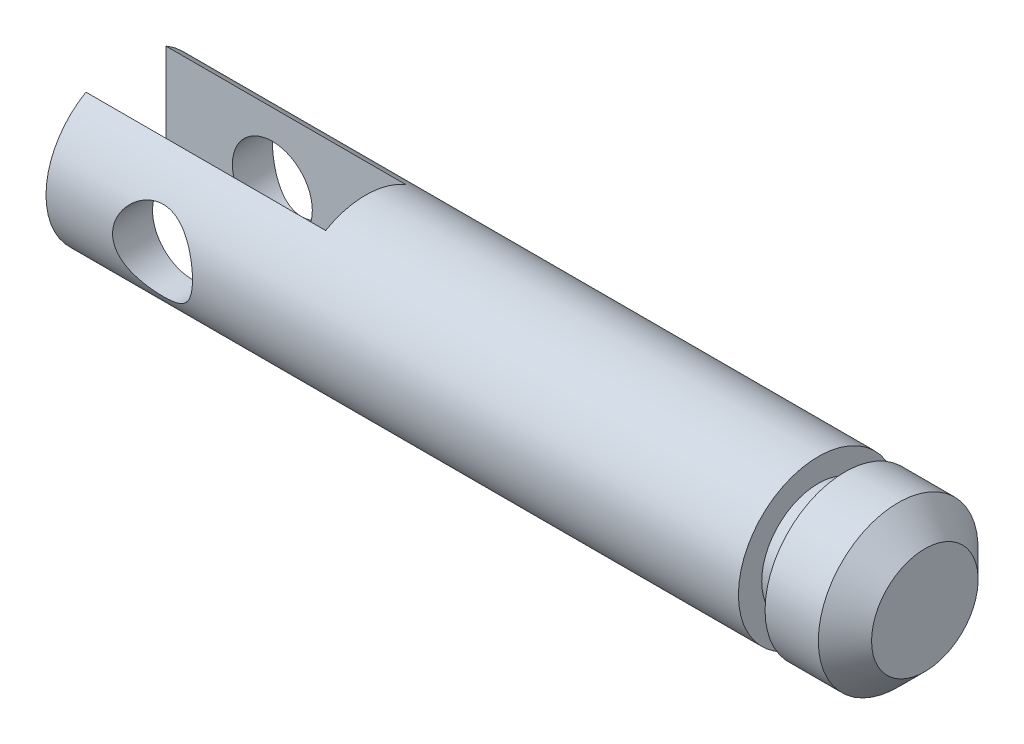
from build123d import *

# Parameters (mm, degrees)
CUT_EXTRUDE1_DEPTH      = 31.298514815
CUT_EXTRUDE1_DEPTH_BACK = 31.298514815
SKETCH2_W               = 9
SKETCH2_H               = 3
CUT_EXTRUDE2_DEPTH      = 31.298514815
CUT_EXTRUDE2_DEPTH_BACK = 31.298514815
SKETCH3_R               = 1.5


with BuildPart() as part:
    # Sketch1 → Revolve1 (revolve)
    with BuildSketch(Plane.XY, mode=Mode.PRIVATE) as revolve1_sk:
        Polygon((30, 0), (30, 2), (29, 3), (27, 3), (27, 2.125), (26, 2.125), (26, 3), (0, 3), (0, 0), align=None)
    revolve(revolve1_sk.sketch.rotate(Axis((0, 0, 0), (1, 0, 0)), 90), axis=Axis((0, 0, 0), (1, 0, 0)))

    # Sketch2 → Cut-Extrude1 (cut, two sides: drawn at the far end of the back side and taken through both)
    with BuildSketch(Plane(origin=(0, 0, 0), x_dir=(1, 0, 0), z_dir=(0, 1, 0)).offset(-CUT_EXTRUDE1_DEPTH_BACK)):
        with Locations((4.5, 0)):
            Rectangle(SKETCH2_W, SKETCH2_H)
    extrude(amount=CUT_EXTRUDE1_DEPTH + CUT_EXTRUDE1_DEPTH_BACK, mode=Mode.SUBTRACT)

    # Sketch3 → Cut-Extrude2 (cut, two sides: drawn at the far end of the back side and taken through both)
    with BuildSketch(Plane.XY.offset(-CUT_EXTRUDE2_DEPTH_BACK)):
        with Locations((4, 0)):
            Circle(SKETCH3_R)
    extrude(amount=CUT_EXTRUDE2_DEPTH + CUT_EXTRUDE2_DEPTH_BACK, mode=Mode.SUBTRACT)


solid = part.part
